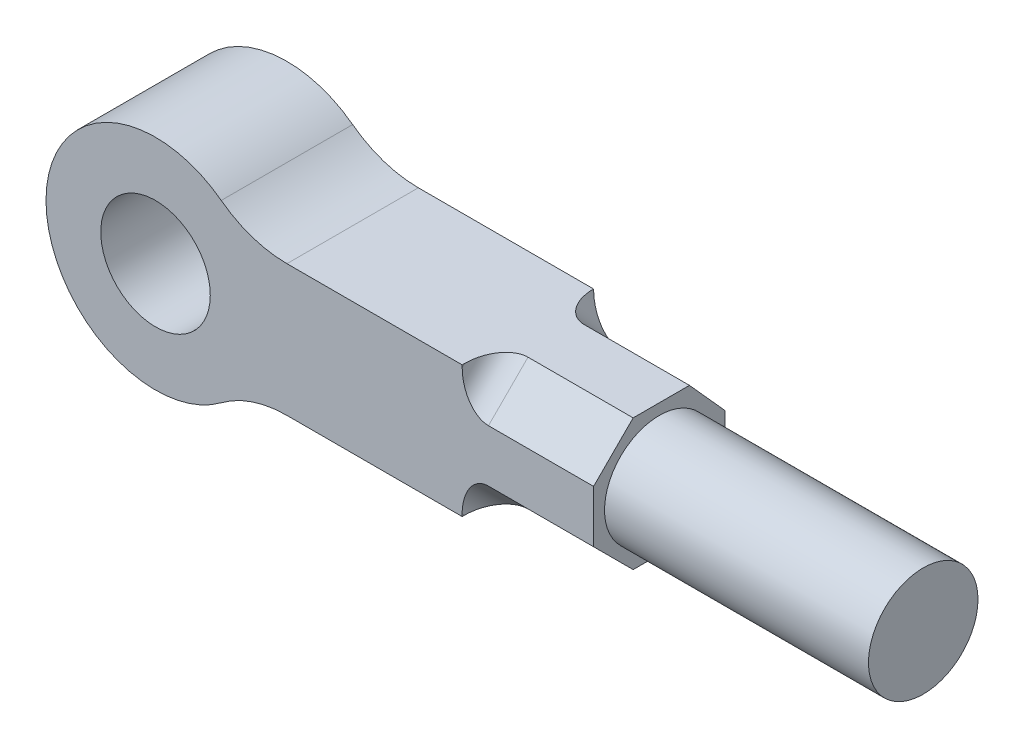
from build123d import *

# Parameters (mm, degrees)
SKETCH1_R           = 25
BOSS_EXTRUDE1_DEPTH = 60
SKETCH2_R           = 25
BOSS_EXTRUDE2_DEPTH = 120.5
CUT_EXTRUDE5_DEPTH  = 60
FILLET1_R           = 12


with BuildPart() as part:
    # Sketch1 → Boss-Extrude1 (new body)
    with BuildSketch(Plane.XY):
        with BuildLine():
            Line((60, 30), (200, 30))
            Line((200, 30), (200, -30))
            Line((200, -30), (60, -30))
            ThreePointArc((60, -30), (44.188611699, -32.565835097), (30, -40))
            ThreePointArc((30, -40), (-50, 0), (30, 40))
            ThreePointArc((30, 40), (44.188611699, 32.565835097), (60, 30))
        make_face()
        Circle(SKETCH1_R, mode=Mode.SUBTRACT)
    extrude(amount=BOSS_EXTRUDE1_DEPTH)

    # Sketch2 → Boss-Extrude2 (add)
    with BuildSketch(Plane(origin=(200, 0, 0), x_dir=(0, 0, -1), z_dir=(1, 0, 0))):
        with Locations((-30, 0)):
            Circle(SKETCH2_R)
    extrude(amount=BOSS_EXTRUDE2_DEPTH)

    # Sketch8 → Cut-Extrude5 (cut)
    with BuildSketch(Plane(origin=(200, 0, 0), x_dir=(0, 0, -1), z_dir=(1, 0, 0))):
        Polygon((-60, 11.94), (-41.94, 30), (-60, 30), align=None)
        Polygon((0, 30), (-16.229667357, 30), (0, 11.94), align=None)
        Polygon((-41.94, -30), (-60, -11.94), (-60, -30), align=None)
        Polygon((0, -30), (0, -11.94), (-18.06, -30), align=None)
    extrude(amount=-CUT_EXTRUDE5_DEPTH, mode=Mode.SUBTRACT)

    # Fillet1
    fillet1_edges = [part.edges().sort_by_distance(p)[0] for p in [
        (140, -20.97, 50.97),
        (140, -20.97, 9.03),
        (140, 20.97, 8.114833678),
        (140, 20.97, 50.97),
    ]]
    fillet(fillet1_edges, radius=FILLET1_R)


solid = part.part
